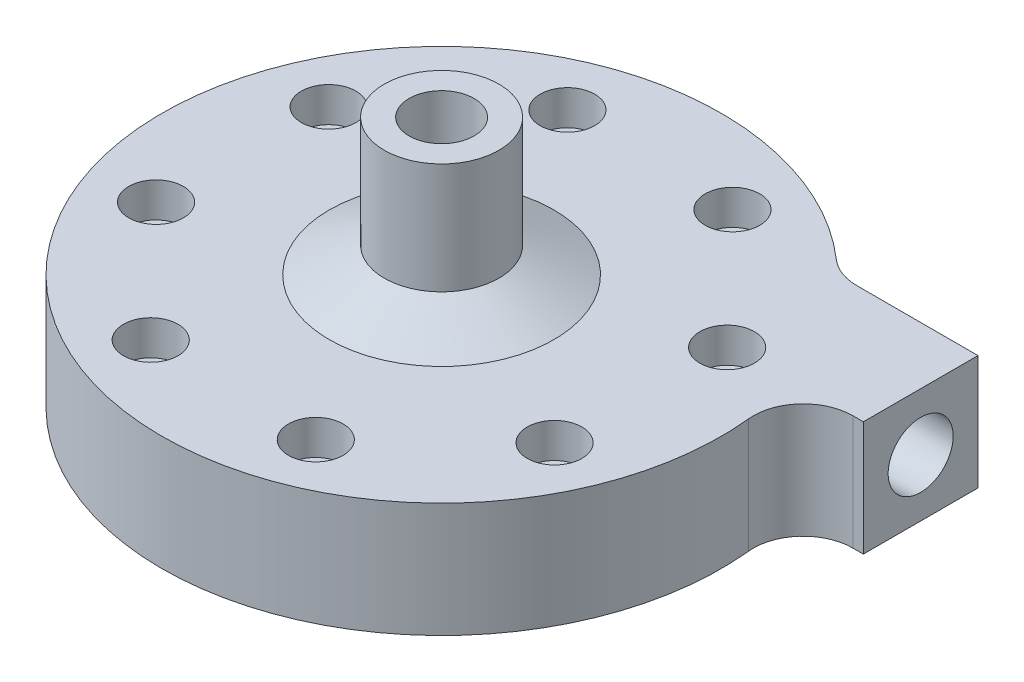
from build123d import *

# Parameters (mm, degrees)
MAIN_BODY_DEPTH           = 23.096874812
SKETCH7_R                 = 25.4
INLET_BOSS_DEPTH          = 50.8
SKETCH5_R                 = 2.9765625
BOLT_CLEARANCES_DEPTH     = 93.591040806
SKETCH6_R                 = 5.500000049
BOLT_HEAD_CLEARANCE_DEPTH = 6.99999997


with BuildPart() as part:
    # Sketch1 → main body (new body)
    with BuildSketch(Plane(origin=(0, 0, 0), x_dir=(1, 0, 0), z_dir=(0, 1, 0))):
        with BuildLine():
            Line((68.126440269, 28.3845), (68.126440269, 39.932937406))
            Line((68.126440269, 39.932937406), (43.701872684, 39.932937406))
            ThreePointArc((43.701872684, 39.932937406), (40.184045793, 40.572120456), (37.115925967, 42.407958613))
            ThreePointArc((37.115925967, 42.407958613), (-50.051959252, -25.900353068), (56.056390774, 5.805856307))
            ThreePointArc((56.056390774, 5.805856307), (58.576808927, 13.532999847), (66.003182971, 16.836062594))
            Line((66.003182971, 16.836062594), (68.126440269, 16.836062594))
            Line((68.126440269, 16.836062594), (68.126440269, 28.3845))
        make_face()
    extrude(amount=MAIN_BODY_DEPTH)

    # Sketch7 → inlet boss (add)
    with BuildSketch(Plane(origin=(0, 23.096874812, 0), x_dir=(1, 0, 0), z_dir=(0, 1, 0))):
        with Locations(Location((0, 0, 0), (0, 0, 270))):
            Circle(SKETCH7_R)
    extrude(amount=INLET_BOSS_DEPTH)

    # Sketch3 → expansion cone and outlet (revolve, cut)
    with BuildSketch(Plane(origin=(0, 11.548437406, 0), x_dir=(1, 0, 0), z_dir=(0, 1, 0))):
        Polygon((21.116967457, 30.6705), (0, 30.6705), (0, 28.3845), (2.48332197, 28.3845), (50.126440201, 28.3845), (68.126440269, 28.3845), (68.126440269, 34.9329375), (50.126440201, 34.9329375), (50.126440201, 33.2085), align=None)
    revolve(axis=Axis((50.126440201, 11.548437406, -28.3845), (-1, 0, 0)), mode=Mode.SUBTRACT)

    # Sketch2 → main chamber (revolve, cut)
    with BuildSketch(Plane.XY, mode=Mode.PRIVATE) as main_chamber_sk:
        Polygon((0, 25.038131431), (0, 13.370212309), (0, 10.870212229), (0, 0), (30.6705, 0), (30.6705, 10.870212229), (30.6705, 13.282748523), (30.6705, 13.8344375), (5.461, 25.589820408), (5.461, 35.589820474), (6.5484375, 35.589820474), (6.5484375, 50.589820446), (11.548437406, 50.589820446), (11.548437406, 28.268091218), (22.638146374, 23.096875), (25.4, 23.096875), (25.4, 73.896875), (0, 73.896875), (0, 50.589820446), (0, 25.589820408), align=None)
    revolve(main_chamber_sk.sketch.rotate(Axis((0, 25.038131431, 0), (0, -1, 0)), 180), axis=Axis((0, 25.038131431, 0), (0, -1, 0)), mode=Mode.SUBTRACT)

    # Sketch5 → bolt clearances (cut, through all)
    with BuildSketch(Plane(origin=(0, 23.096874812, 0), x_dir=(1, 0, 0), z_dir=(0, 1, 0))):
        with Locations(Location((41.435066256, 16.091543876, 0), (0, 0, 270))):
            Circle(SKETCH5_R)
        with Locations(Location((40.677456124, -17.920576534, 0), (0, 0, 270))):
            Circle(SKETCH5_R)
        with Locations(Location((16.091543876, -41.435066256, 0), (0, 0, 270))):
            Circle(SKETCH5_R)
        with Locations(Location((-17.920576534, -40.677456124, 0), (0, 0, 270))):
            Circle(SKETCH5_R)
        with Locations(Location((-41.435066256, -16.091543876, 0), (0, 0, 270))):
            Circle(SKETCH5_R)
        with Locations(Location((-40.677456124, 17.920576534, 0), (0, 0, 270))):
            Circle(SKETCH5_R)
        with Locations(Location((-16.091543876, 41.435066256, 0), (0, 0, 270))):
            Circle(SKETCH5_R)
        with Locations(Location((17.920576534, 40.677456124, 0), (0, 0, 270))):
            Circle(SKETCH5_R)
    extrude(amount=-BOLT_CLEARANCES_DEPTH, mode=Mode.SUBTRACT)

    # Sketch6 → bolt head clearance (cut)
    with BuildSketch(Plane(origin=(0, 23.096874812, 0), x_dir=(1, 0, 0), z_dir=(0, 1, 0))):
        with Locations(Location((41.435066256, 16.091543876, 0), (0, 0, 270))):
            Circle(SKETCH6_R)
        with Locations(Location((40.677456124, -17.920576534, 0), (0, 0, 270))):
            Circle(SKETCH6_R)
        with Locations(Location((16.091543876, -41.435066256, 0), (0, 0, 270))):
            Circle(SKETCH6_R)
        with Locations(Location((-17.920576534, -40.677456124, 0), (0, 0, 270))):
            Circle(SKETCH6_R)
        with Locations(Location((-41.435066256, -16.091543876, 0), (0, 0, 270))):
            Circle(SKETCH6_R)
        with Locations(Location((-40.677456124, 17.920576534, 0), (0, 0, 270))):
            Circle(SKETCH6_R)
        with Locations(Location((-16.091543876, 41.435066256, 0), (0, 0, 270))):
            Circle(SKETCH6_R)
        with Locations(Location((17.920576534, 40.677456124, 0), (0, 0, 270))):
            Circle(SKETCH6_R)
    extrude(amount=-BOLT_HEAD_CLEARANCE_DEPTH, mode=Mode.SUBTRACT)


solid = part.part
